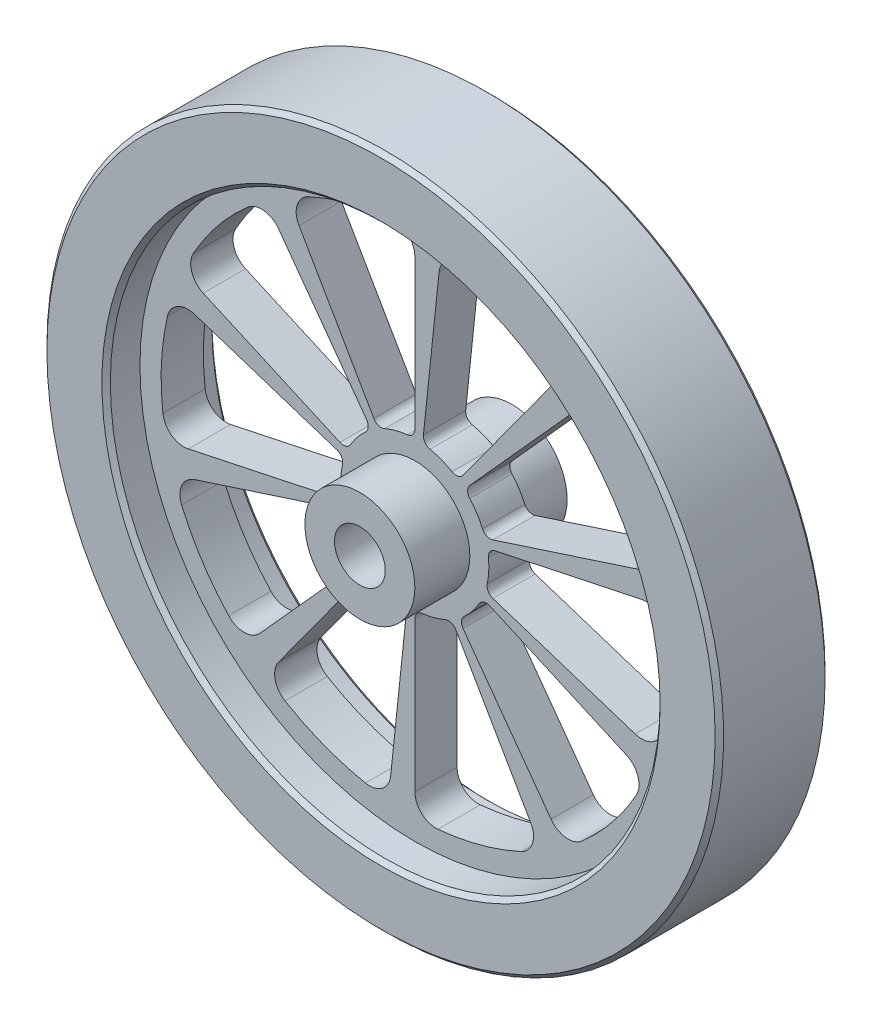
from build123d import *

# Parameters (mm, degrees)
SKETCH1_R           = 80
SKETCH1_R_2         = 6
BOSS_EXTRUDE1_DEPTH = 13
SKETCH2_R           = 65
CUT_EXTRUDE1_DEPTH  = 8
SKETCH3_R           = 13
SKETCH3_R_2         = 6
BOSS_EXTRUDE2_DEPTH = 18
CHAMFER1_SIZE       = 1
CUT_EXTRUDE2_DEPTH  = 116.451288429
CIRPATTERN2_COUNT   = 10


with BuildPart() as part:
    # Sketch1 → Boss-Extrude1 (new, symmetric)
    with BuildSketch(Plane.XY):
        with Locations(Location((0, 0, 0), (0, 0, 180))):
            Circle(SKETCH1_R)
        with Locations(Location((0, 0, 0), (0, 0, 180))):
            Circle(SKETCH1_R_2, mode=Mode.SUBTRACT)
    extrude(amount=BOSS_EXTRUDE1_DEPTH, both=True)

    # Sketch2 → Cut-Extrude1 (cut)
    with BuildSketch(Plane.XY.offset(13)):
        Circle(SKETCH2_R)
    cut_extrude1 = extrude(amount=-CUT_EXTRUDE1_DEPTH, mode=Mode.SUBTRACT)

    # Mirror1: Cut-Extrude1 across plane
    add(cut_extrude1.mirror(Plane.XY), mode=Mode.SUBTRACT)

    # Sketch3 → Boss-Extrude2 (add, symmetric)
    with BuildSketch(Plane.XY):
        with Locations(Location((0, 0, 0), (0, 0, 180))):
            Circle(SKETCH3_R)
        with Locations(Location((0, 0, 0), (0, 0, 180))):
            Circle(SKETCH3_R_2, mode=Mode.SUBTRACT)
    extrude(amount=BOSS_EXTRUDE2_DEPTH, both=True)

    # Chamfer1
    chamfer1_edges = [part.edges().sort_by_distance(p)[0] for p in [
        (-65, 0, 13),
        (-65, 0, -13),
        (80, 0, -13),
        (80, 0, 13),
    ]]
    chamfer(chamfer1_edges, length=CHAMFER1_SIZE)

    # Sketch4 → Cut-Extrude2 (cut, through all)
    with BuildSketch(Plane.XY.offset(5)):
        with BuildLine():
            Line((0, 54.772255751), (0, 19.397164741))
            ThreePointArc((0, 19.397164741), (-0.515032591, 18.057436487), (-1.794871795, 17.407711947))
            ThreePointArc((-1.794871795, 17.407711947), (-4.529333289, 16.90370196), (-7.149451403, 15.972956666))
            ThreePointArc((-7.149451403, 15.972956666), (-8.582686936, 15.895715021), (-9.698582371, 16.798437427))
            Line((-9.698582371, 16.798437427), (-27.386127875, 47.434164903))
            ThreePointArc((-27.386127875, 47.434164903), (-27.821744262, 51.446675992), (-25.152000934, 54.473634439))
            ThreePointArc((-25.152000934, 54.473634439), (-15.529142706, 57.955549577), (-5.454545455, 59.751551728))
            ThreePointArc((-5.454545455, 59.751551728), (-1.629000688, 58.46500048), (0, 54.772255751))
        make_face()
    cut_extrude2 = extrude(amount=-CUT_EXTRUDE2_DEPTH, mode=Mode.SUBTRACT)

    # CirPattern2: Cut-Extrude2 ×10 about axis
    cirpattern2_axis = Axis((0, 0, 0), (0, 0, 1))
    for i in range(1, CIRPATTERN2_COUNT):
        add(cut_extrude2.rotate(cirpattern2_axis, i * 360 / CIRPATTERN2_COUNT), mode=Mode.SUBTRACT)


solid = part.part
